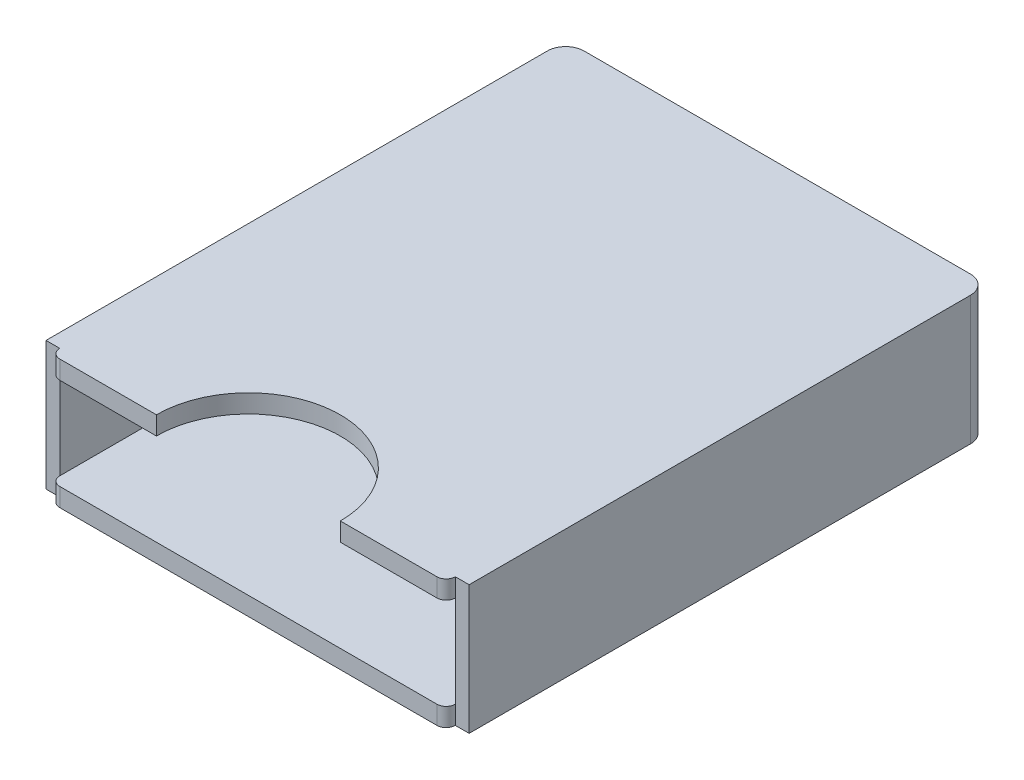
from build123d import *

# Parameters (mm, degrees)
BOSS_EXTRUDE23_DEPTH = 1
BOSS_EXTRUDE27_DEPTH = 6
BOSS_EXTRUDE28_START = 6
BOSS_EXTRUDE28_DEPTH = 1
CUT_EXTRUDE9_DEPTH   = 1
SKETCH15_W           = 10
SKETCH15_H           = 2
CUT_EXTRUDE11_DEPTH  = 10


with BuildPart() as part:
    # Sketch10 → Boss-Extrude23 (new body)
    with BuildSketch(Plane(origin=(0, 0, 0), x_dir=(1, 0, 0), z_dir=(0, 1, 0))):
        with BuildLine():
            Line((-11.5, -13.5), (-10.75, -13.5))
            ThreePointArc((-10.75, -13.5), (-10.603553391, -13.853553391), (-10.25, -14))
            Line((-10.25, -14), (10.25, -14))
            ThreePointArc((10.25, -14), (10.603553391, -13.853553391), (10.75, -13.5))
            Line((10.75, -13.5), (11.5, -13.5))
            Line((11.5, -13.5), (11.5, 13.75))
            ThreePointArc((11.5, 13.75), (11.207106781, 14.457106781), (10.5, 14.75))
            Line((10.5, 14.75), (-10.5, 14.75))
            ThreePointArc((-10.5, 14.75), (-11.207106781, 14.457106781), (-11.5, 13.75))
            Line((-11.5, 13.75), (-11.5, -13.5))
        make_face()
    extrude(amount=BOSS_EXTRUDE23_DEPTH)

    # Sketch10<6> → Boss-Extrude27 (add)
    with BuildSketch(Plane(origin=(0, 0, 0), x_dir=(1, 0, 0), z_dir=(0, 1, 0))):
        with BuildLine():
            Line((-11.5, -13.5), (-10.75, -13.5))
            Line((-10.75, -13.5), (-10.75, 13.5))
            ThreePointArc((-10.75, 13.5), (-10.603553391, 13.853553391), (-10.25, 14))
            Line((-10.25, 14), (10.25, 14))
            ThreePointArc((10.25, 14), (10.603553391, 13.853553391), (10.75, 13.5))
            Line((10.75, 13.5), (10.75, -13.5))
            Line((10.75, -13.5), (11.5, -13.5))
            Line((11.5, -13.5), (11.5, 13.75))
            ThreePointArc((11.5, 13.75), (11.207106781, 14.457106781), (10.5, 14.75))
            Line((10.5, 14.75), (4.75, 14.75))
            Line((4.75, 14.75), (-4.75, 14.75))
            Line((-4.75, 14.75), (-10.5, 14.75))
            ThreePointArc((-10.5, 14.75), (-11.207106781, 14.457106781), (-11.5, 13.75))
            Line((-11.5, 13.75), (-11.5, -13.5))
        make_face()
    extrude(amount=BOSS_EXTRUDE27_DEPTH)

    # Sketch10<7> → Boss-Extrude28 (add)
    with BuildSketch(Plane(origin=(0, 0, 0), x_dir=(1, 0, 0), z_dir=(0, 1, 0)).offset(BOSS_EXTRUDE28_START)):
        with BuildLine():
            Line((-11.5, -13.5), (-10.75, -13.5))
            ThreePointArc((-10.75, -13.5), (-10.603553391, -13.853553391), (-10.25, -14))
            Line((-10.25, -14), (10.25, -14))
            ThreePointArc((10.25, -14), (10.603553391, -13.853553391), (10.75, -13.5))
            Line((10.75, -13.5), (11.5, -13.5))
            Line((11.5, -13.5), (11.5, 13.75))
            ThreePointArc((11.5, 13.75), (11.207106781, 14.457106781), (10.5, 14.75))
            Line((10.5, 14.75), (-10.5, 14.75))
            ThreePointArc((-10.5, 14.75), (-11.207106781, 14.457106781), (-11.5, 13.75))
            Line((-11.5, 13.75), (-11.5, -13.5))
        make_face()
    extrude(amount=BOSS_EXTRUDE28_DEPTH)

    # Sketch13 → Cut-Extrude9 (cut)
    with BuildSketch(Plane(origin=(0, 7, 0), x_dir=(1, 0, 0), z_dir=(0, 1, 0))):
        with BuildLine():
            Line((-5, -14), (5, -14))
            ThreePointArc((5, -14), (0, -9), (-5, -14))
        make_face()
    extrude(amount=-CUT_EXTRUDE9_DEPTH, mode=Mode.SUBTRACT)

    # Sketch15 → Cut-Extrude11 (cut)
    with BuildSketch(Plane(origin=(0, 0, -14.75), x_dir=(-1, 0, 0), z_dir=(0, 0, -1))):
        with Locations((0, 2)):
            Rectangle(SKETCH15_W, SKETCH15_H)
    extrude(amount=-CUT_EXTRUDE11_DEPTH, mode=Mode.SUBTRACT)


solid = part.part
